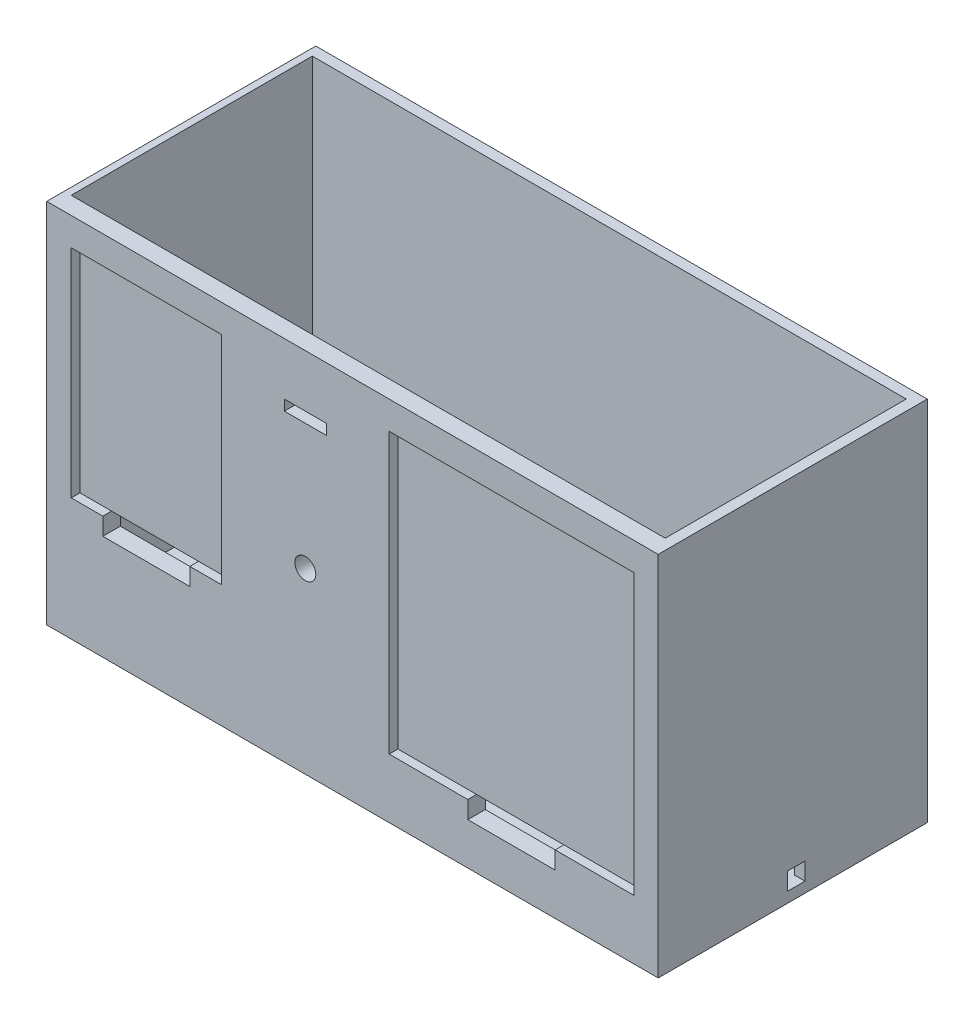
from build123d import *

# Parameters (mm, degrees)
SKETCH1_W           = 175
SKETCH1_H           = 77
SKETCH1_W_2         = 170
SKETCH1_H_2         = 69
BOSS_EXTRUDE1_DEPTH = 105
SKETCH2_W           = 175
SKETCH2_H           = 77
BOSS_EXTRUDE2_DEPTH = 3
SKETCH3_W           = 70
SKETCH3_H           = 80
SKETCH3_W_2         = 43
SKETCH3_H_2         = 62
CUT_EXTRUDE1_DEPTH  = 2.5
SKETCH4_W           = 12
SKETCH4_H           = 3
SKETCH4_W_2         = 24.903681778
SKETCH4_H_2         = 5
SKETCH4_W_3         = 25
SKETCH4_R           = 3
CUT_EXTRUDE2_DEPTH  = 12.5
SKETCH5_W           = 17.65
SKETCH5_H           = 18.35
CUT_EXTRUDE3_DEPTH  = 10
SKETCH6_W           = 5
SKETCH6_H           = 5
CUT_EXTRUDE4_DEPTH  = 10


with BuildPart() as part:
    # Sketch1 → Boss-Extrude1 (new body)
    with BuildSketch(Plane(origin=(0, 0, 0), x_dir=(1, 0, 0), z_dir=(0, 1, 0))):
        with Locations((-14.5, -36.5)):
            Rectangle(SKETCH1_W, SKETCH1_H)
        with Locations((-15, -35.5)):
            Rectangle(SKETCH1_W_2, SKETCH1_H_2, mode=Mode.SUBTRACT)
    extrude(amount=BOSS_EXTRUDE1_DEPTH)

    # Sketch2 → Boss-Extrude2 (add)
    with BuildSketch(Plane(origin=(0, 0, 0), x_dir=(-1, 0, 0), z_dir=(0, -1, 0))):
        with Locations((14.5, -36.5)):
            Rectangle(SKETCH2_W, SKETCH2_H)
    extrude(amount=-BOSS_EXTRUDE2_DEPTH)

    # Sketch3 → Cut-Extrude1 (cut)
    with BuildSketch(Plane.XY.offset(75)):
        with Locations((31, 57)):
            Rectangle(SKETCH3_W, SKETCH3_H)
        with Locations((-73.5, 66)):
            Rectangle(SKETCH3_W_2, SKETCH3_H_2)
    extrude(amount=-CUT_EXTRUDE1_DEPTH, mode=Mode.SUBTRACT)

    # Sketch4 → Cut-Extrude2 (cut)
    with BuildSketch(Plane.XY.offset(75)):
        with Locations((-28, 88.5)):
            Rectangle(SKETCH4_W, SKETCH4_H)
        with Locations((-73.5, 32.5)):
            Rectangle(SKETCH4_W_2, SKETCH4_H_2)
        with Locations((31, 14.5)):
            Rectangle(SKETCH4_W_3, SKETCH4_H_2)
        with Locations((-28, 51)):
            Circle(SKETCH4_R)
    extrude(amount=-CUT_EXTRUDE2_DEPTH, mode=Mode.SUBTRACT)

    # Sketch5 → Cut-Extrude3 (cut)
    with BuildSketch(Plane.XY.offset(1)):
        with Locations((48.75, 12.175)):
            Rectangle(SKETCH5_W, SKETCH5_H)
    extrude(amount=-CUT_EXTRUDE3_DEPTH, mode=Mode.SUBTRACT)

    # Sketch6 → Cut-Extrude4 (cut)
    with BuildSketch(Plane.ZY.offset(-70)):
        with Locations((35.5, 5.5)):
            Rectangle(SKETCH6_W, SKETCH6_H)
    extrude(amount=-CUT_EXTRUDE4_DEPTH, mode=Mode.SUBTRACT)


solid = part.part
